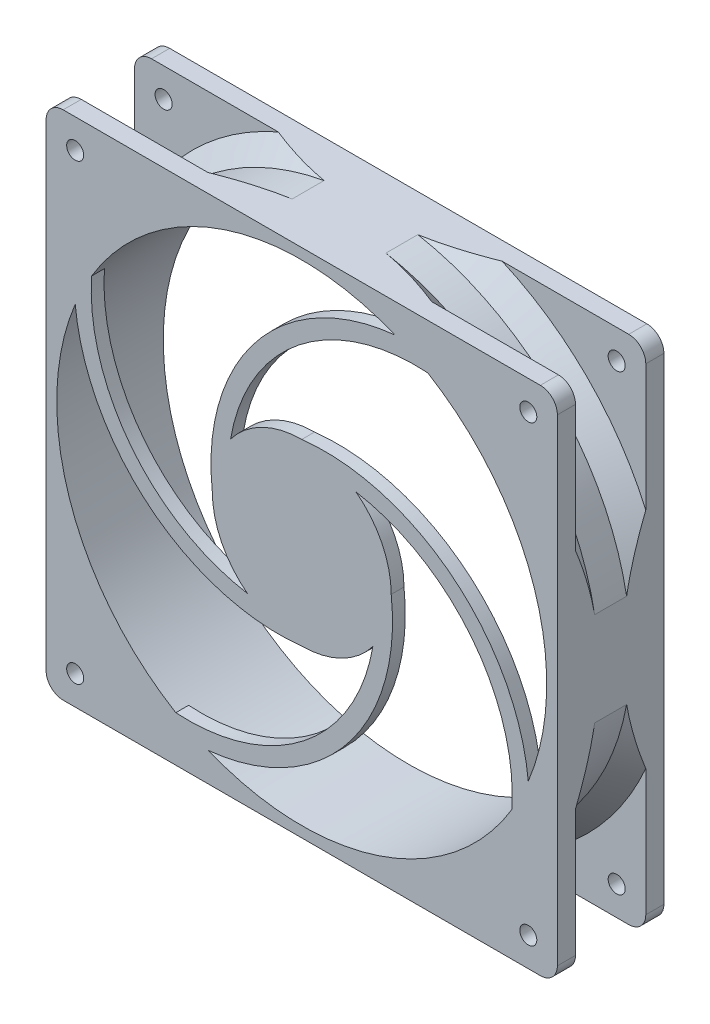
from build123d import *

# Parameters (mm, degrees)
SKETCH1_W           = 120
SKETCH1_H           = 120
SKETCH1_R           = 57.5
BOSS_EXTRUDE1_DEPTH = 25
FILLET1_R           = 4
SKETCH3_R           = 2
CUT_EXTRUDE1_DEPTH  = 89.459030065
BOSS_EXTRUDE2_START = -3
BOSS_EXTRUDE2_DEPTH = 3


with BuildPart() as part:
    # Sketch1 → Boss-Extrude1 (new body)
    with BuildSketch(Plane.XY):
        Rectangle(SKETCH1_W, SKETCH1_H)
        Circle(SKETCH1_R, mode=Mode.SUBTRACT)
    extrude(amount=BOSS_EXTRUDE1_DEPTH)

    # Fillet1
    fillet1_edges = [part.edges().sort_by_distance(p)[0] for p in [
        (-60, 60, 12.5),
        (60, 60, 12.5),
        (60, -60, 12.5),
        (-60, -60, 12.5),
    ]]
    fillet(fillet1_edges, radius=FILLET1_R)

    # Sketch2 → Cut-Revolve1 (revolve, cut)
    with BuildSketch(Plane(origin=(0, 0, 0), x_dir=(1, 0, 0), z_dir=(0, 1, 0))):
        Polygon((61, -8.75), (61, -16.25), (65.5, -20.75), (86, -20.75), (86, -4.25), (65.5, -4.25), align=None)
    revolve(axis=Axis((0, 0, 0), (0, 0, 1)), mode=Mode.SUBTRACT)

    # Sketch3 → Cut-Extrude1 (cut, through all)
    with BuildSketch(Plane(origin=(0, 0, 0), x_dir=(-1, 0, 0), z_dir=(0, 0, -1))):
        with Locations((-53.171572875, 53.171572875)):
            Circle(SKETCH3_R)
        with Locations((53.171572875, 53.171572875)):
            Circle(SKETCH3_R)
        with Locations((53.171572875, -53.171572875)):
            Circle(SKETCH3_R)
        with Locations((-53.171572875, -53.171572875)):
            Circle(SKETCH3_R)
    extrude(amount=-CUT_EXTRUDE1_DEPTH, mode=Mode.SUBTRACT)

    # Sketch4 → Boss-Extrude2 (add)
    with BuildSketch(Plane.XY.offset(25).offset(BOSS_EXTRUDE2_START)):
        with BuildLine():
            ThreePointArc((0, 21), (-9.310739966, 18.823127298), (-16.691166059, 12.743821075))
            ThreePointArc((-16.691166059, 12.743821075), (-0.598422961, 39.925677295), (29.560959215, 49.319364252))
            ThreePointArc((29.560959215, 49.319364252), (25.795909203, 51.388919704), (21.886841663, 53.171572875))
            ThreePointArc((21.886841663, 53.171572875), (-10.667756929, 35.547780517), (-21, 0))
            ThreePointArc((-21, 0), (-18.823127298, -9.310739966), (-12.743821075, -16.691166059))
            ThreePointArc((-12.743821075, -16.691166059), (-39.925677295, -0.598422961), (-49.319364252, 29.560959215))
            ThreePointArc((-49.319364252, 29.560959215), (-51.388919704, 25.795909203), (-53.171572875, 21.886841663))
            ThreePointArc((-53.171572875, 21.886841663), (-35.547780517, -10.667756929), (0, -21))
            ThreePointArc((0, -21), (9.310739966, -18.823127298), (16.691166059, -12.743821075))
            ThreePointArc((16.691166059, -12.743821075), (0.598422961, -39.925677295), (-29.560959215, -49.319364252))
            ThreePointArc((-29.560959215, -49.319364252), (-25.795909203, -51.388919704), (-21.886841663, -53.171572875))
            ThreePointArc((-21.886841663, -53.171572875), (10.667756929, -35.547780517), (21, 0))
            ThreePointArc((21, 0), (18.823127298, 9.310739966), (12.743821075, 16.691166059))
            ThreePointArc((12.743821075, 16.691166059), (39.925677295, 0.598422961), (49.319364252, -29.560959215))
            ThreePointArc((49.319364252, -29.560959215), (51.388919704, -25.795909203), (53.171572875, -21.886841663))
            ThreePointArc((53.171572875, -21.886841663), (35.547780517, 10.667756929), (0, 21))
        make_face()
    extrude(amount=BOSS_EXTRUDE2_DEPTH)


solid = part.part
